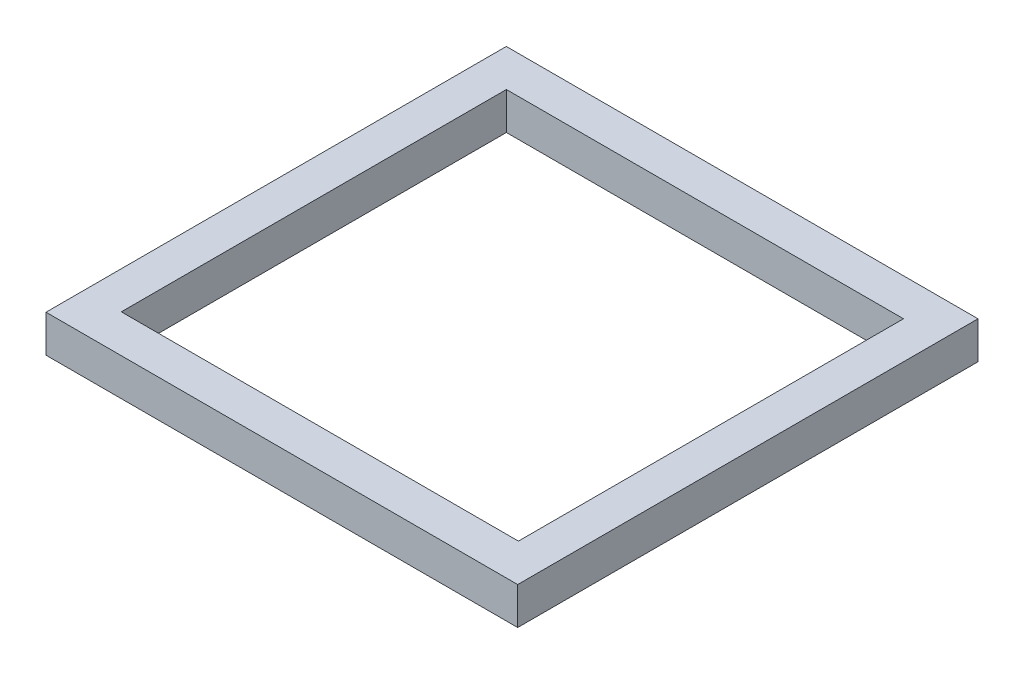
from build123d import *

# Parameters (mm, degrees)
SKETCH1_W           = 1266.271829393
SKETCH1_H           = 1235.704141756
SKETCH1_W_2         = 1066.072664352
SKETCH1_H_2         = 1033.747851994
BOSS_EXTRUDE1_DEPTH = 100


with BuildPart() as part:
    # Sketch1 → Boss-Extrude1 (new body)
    with BuildSketch(Plane(origin=(0, 0, 0), x_dir=(1, 0, 0), z_dir=(0, 1, 0))):
        with Locations((-33.135914697, -17.852070878)):
            Rectangle(SKETCH1_W, SKETCH1_H)
        with Locations((-33.036332176, -16.873925997)):
            Rectangle(SKETCH1_W_2, SKETCH1_H_2, mode=Mode.SUBTRACT)
    extrude(amount=BOSS_EXTRUDE1_DEPTH)


solid = part.part
